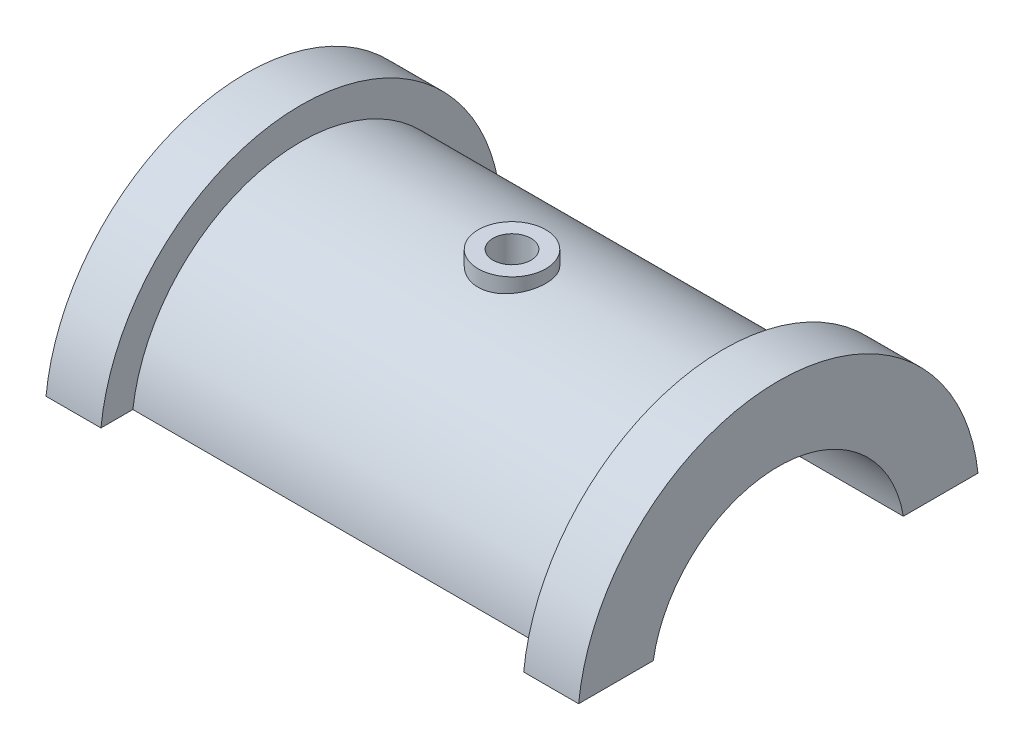
from build123d import *

# Parameters (mm, degrees)
SKETCH2_R                   = 30
CUT_EXTRUDE1_DEPTH          = 143.788304843
BOSS_EXTRUDE1_REACH         = 164.242
BOSS_EXTRUDE1_END_RADIUS    = 40
SKETCH3_R                   = 8
M10X1_0_TAPPED_HOLE1_REACH  = 164.242
M10X1_0_TAPPED_HOLE1_BORE_R = 4.5
CUT_EXTRUDE2_DEPTH          = 143.788304931
CUT_EXTRUDE2_DEPTH_BACK     = 143.788304931


with BuildPart() as part:
    # Sketch1 → Revolve1 (revolve)
    with BuildSketch(Plane.XY, mode=Mode.PRIVATE) as revolve1_sk:
        Polygon((0, 0), (0, 47.5), (13, 47.5), (13, 40), (113, 40), (113, 47.5), (126, 47.5), (126, 0), align=None)
    revolve(revolve1_sk.sketch.rotate(Axis((126, 0, 0), (-1, 0, 0)), 90), axis=Axis((126, 0, 0), (-1, 0, 0)))

    # Sketch2 → Cut-Extrude1 (cut, through all)
    with BuildSketch(Plane(origin=(126, 0, 0), x_dir=(0, 0, -1), z_dir=(1, 0, 0))):
        Circle(SKETCH2_R)
    extrude(amount=-CUT_EXTRUDE1_DEPTH, mode=Mode.SUBTRACT)

    # Boss-Extrude1: up to this cylinder (the profile starts outside it)
    boss_extrude1_end = Plane(origin=(63, 0, 0), z_dir=(1, 0, 0)) * Cylinder(BOSS_EXTRUDE1_END_RADIUS, 409.484, mode=Mode.PRIVATE)
    # Sketch3 → Boss-Extrude1 (add, up to the surface)
    with BuildSketch(Plane(origin=(0, 43, 0), x_dir=(1, 0, 0), z_dir=(0, 1, 0)), mode=Mode.PRIVATE) as boss_extrude1_sk1:
        with Locations(Location((63, 0, 0), (0, 0, 270))):
            Circle(SKETCH3_R)
    boss_extrude1_tool1 = extrude(boss_extrude1_sk1.sketch, amount=-BOSS_EXTRUDE1_REACH, mode=Mode.PRIVATE) - boss_extrude1_end
    add(boss_extrude1_tool1.solids().sort_by_distance((63, 43, 0))[0])

    # M10x1.0 Tapped Hole1 bore → M10x1.0 Tapped Hole1 (cut, up to next)
    with BuildSketch(Plane(origin=(0, 43, 0), x_dir=(1, 0, 0), z_dir=(0, 1, 0)), mode=Mode.PRIVATE) as m10x1_0_tapped_hole1_sk1:
        with Locations((63, 0)):
            Circle(M10X1_0_TAPPED_HOLE1_BORE_R)
    m10x1_0_tapped_hole1_tool1 = extrude(m10x1_0_tapped_hole1_sk1.sketch, amount=-M10X1_0_TAPPED_HOLE1_REACH, mode=Mode.PRIVATE) & part.part
    add(m10x1_0_tapped_hole1_tool1.solids().sort_by_distance((63, 43, 0))[0], mode=Mode.SUBTRACT)

    # Sketch6 → Cut-Extrude2 (cut, two sides: drawn at the far end of the back side and taken through both)
    with BuildSketch(Plane(origin=(126, 0, 0), x_dir=(0, 0, -1), z_dir=(1, 0, 0)).offset(-CUT_EXTRUDE2_DEPTH_BACK)):
        Polygon((-315.109988933, 5), (-62.08548164, 5), (59.692601542, 5), (312.717108835, 5), (312.717108835, -501.049014586), (-315.109988933, -501.049014586), align=None)
    extrude(amount=CUT_EXTRUDE2_DEPTH + CUT_EXTRUDE2_DEPTH_BACK, mode=Mode.SUBTRACT)


solid = part.part
